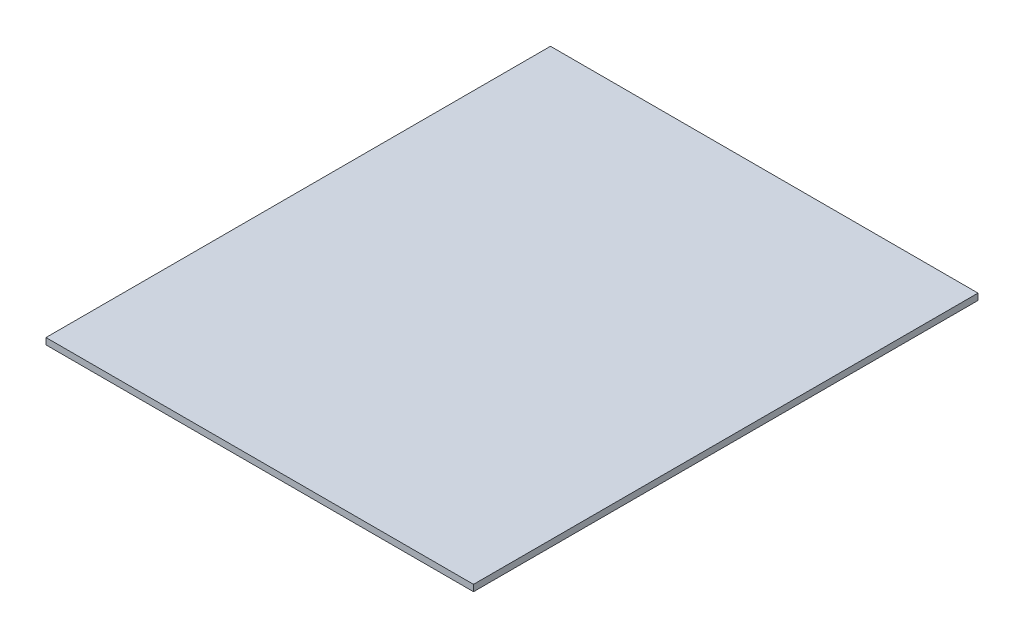
from build123d import *

# Parameters (mm, degrees)
SKETCH1_W           = 200
SKETCH1_H           = 236
BOSS_EXTRUDE1_DEPTH = 3


with BuildPart() as part:
    # Sketch1 → Boss-Extrude1 (new body)
    with BuildSketch(Plane(origin=(0, 0, 0), x_dir=(1, 0, 0), z_dir=(0, 1, 0))):
        with Locations((100, -118)):
            Rectangle(SKETCH1_W, SKETCH1_H)
    extrude(amount=BOSS_EXTRUDE1_DEPTH)


solid = part.part
